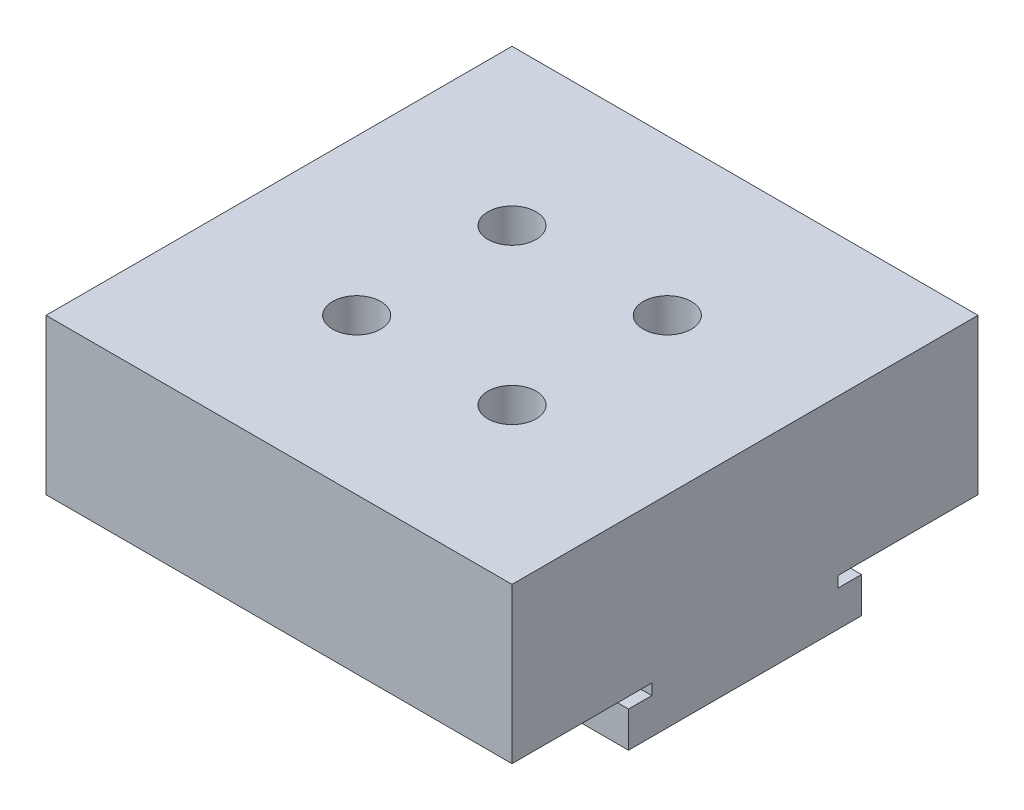
from build123d import *

# Parameters (mm, degrees)
SKETCH_1_W          = 30
SKETCH_1_H          = 30
SKETCH_1_R          = 1.55
EXTRUDE_1_DEPTH     = 10
SKETCH_2_R          = 3.5
CUT_EXTRUDE_1_DEPTH = 3
SKETCH_3_W          = 6
SKETCH_3_H          = 15
EXTRUDE_3_DEPTH     = 3
SKETCH_5_W          = 1.5
SKETCH_5_H          = 0.7
CUT_EXTRUDE_3_DEPTH = 36


with BuildPart() as part:
    # 草图1 → 凸台-拉伸1 (new body)
    with BuildSketch(Plane(origin=(0, 0, 0), x_dir=(1, 0, 0), z_dir=(0, 1, 0))):
        Rectangle(SKETCH_1_W, SKETCH_1_H)
        with Locations(Location((-5, 5, 0), (0, 0, 270))):
            Circle(SKETCH_1_R, mode=Mode.SUBTRACT)
        with Locations(Location((5, 5, 0), (0, 0, 270))):
            Circle(SKETCH_1_R, mode=Mode.SUBTRACT)
        with Locations(Location((5, -5, 0), (0, 0, 270))):
            Circle(SKETCH_1_R, mode=Mode.SUBTRACT)
        with Locations(Location((-5, -5, 0), (0, 0, 270))):
            Circle(SKETCH_1_R, mode=Mode.SUBTRACT)
    extrude(amount=EXTRUDE_1_DEPTH)

    # 草图2 → 切除-拉伸1 (cut)
    with BuildSketch(Plane.XZ):
        with Locations(Location((-5, 5, 0), (0, 0, 270))):
            Circle(SKETCH_2_R)
        with Locations(Location((5, 5, 0), (0, 0, 270))):
            Circle(SKETCH_2_R)
        with Locations(Location((5, -5, 0), (0, 0, 270))):
            Circle(SKETCH_2_R)
        with Locations(Location((-5, -5, 0), (0, 0, 270))):
            Circle(SKETCH_2_R)
    extrude(amount=-CUT_EXTRUDE_1_DEPTH, mode=Mode.SUBTRACT)

    # 草图3 → 凸台-拉伸3 (add)
    with BuildSketch(Plane.XZ):
        with Locations((-12, 0)):
            Rectangle(SKETCH_3_W, SKETCH_3_H)
        with Locations((12, 0)):
            Rectangle(SKETCH_3_W, SKETCH_3_H)
    extrude(amount=EXTRUDE_3_DEPTH)

    # 草图5 → 切除-拉伸3 (cut, through all)
    with BuildSketch(Plane.ZY.offset(15)):
        with Locations((-6.75, -0.35)):
            Rectangle(SKETCH_5_W, SKETCH_5_H)
        with Locations((6.75, -0.35)):
            Rectangle(SKETCH_5_W, SKETCH_5_H)
    extrude(amount=-CUT_EXTRUDE_3_DEPTH, mode=Mode.SUBTRACT)


solid = part.part
